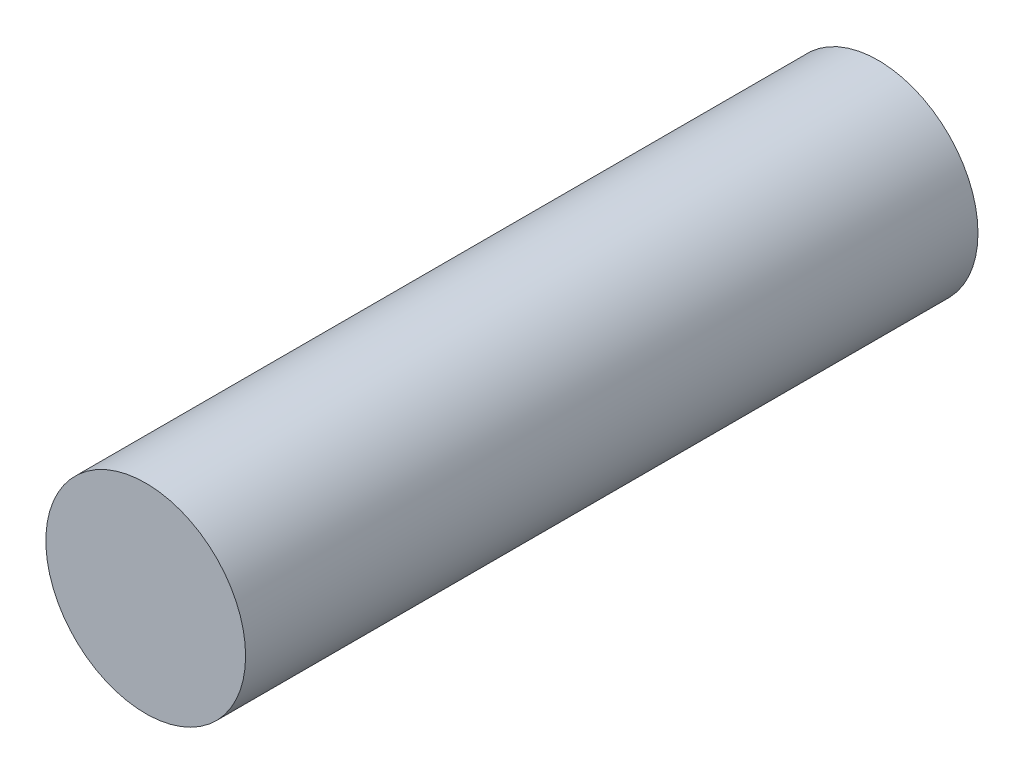
from build123d import *

# Parameters (mm, degrees)
IZIM1_R                     = 9
Y_KSEKLIK_EKSTR_ZYON1_DEPTH = 66


with BuildPart() as part:
    # Çizim1 → Yükseklik-Ekstrüzyon1 (new body)
    with BuildSketch(Plane.XY):
        Circle(IZIM1_R)
    extrude(amount=Y_KSEKLIK_EKSTR_ZYON1_DEPTH)


solid = part.part
